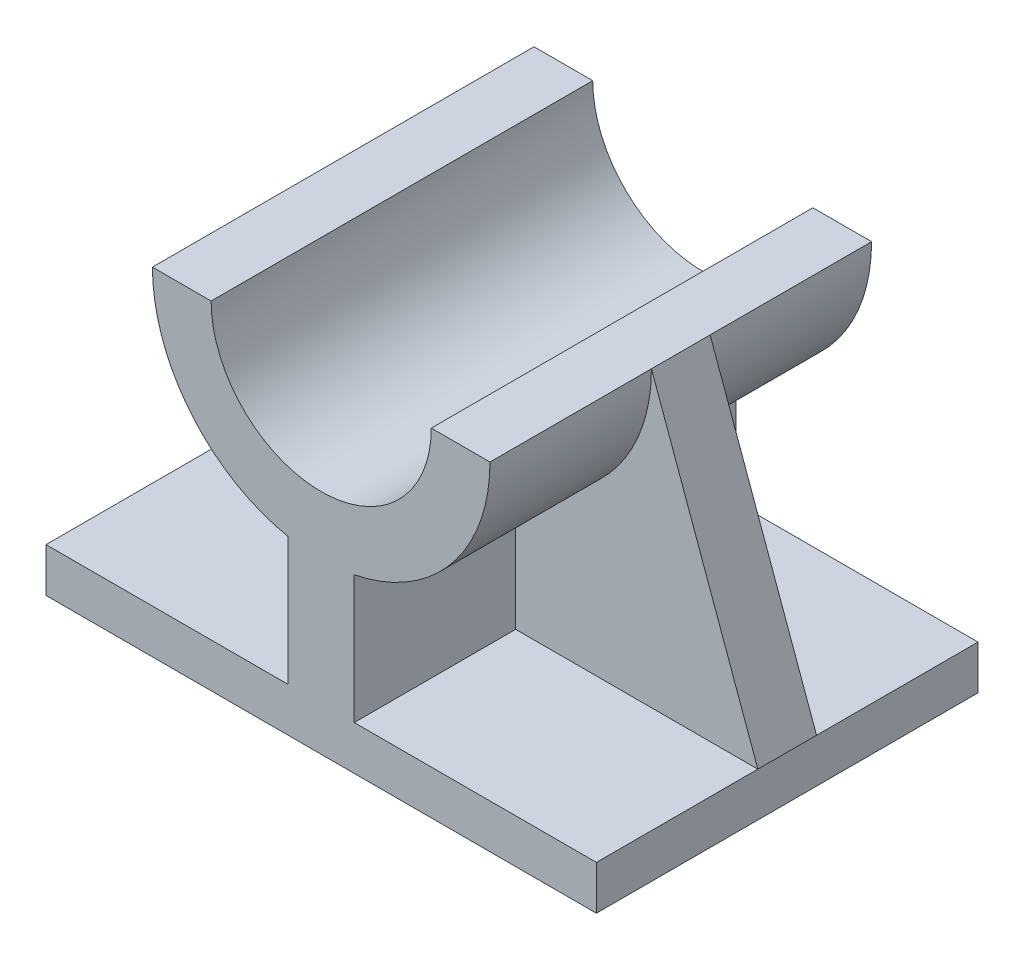
from build123d import *

# Parameters (mm, degrees)
BOSS_EXTRUDE1_DEPTH = 52
BOSS_EXTRUDE2_START = -22
BOSS_EXTRUDE2_DEPTH = 8


with BuildPart() as part:
    # Sketch1 → Boss-Extrude1 (new body)
    with BuildSketch(Plane.XY):
        with BuildLine():
            Line((-4.5, 20.444512863), (-4.5, 3))
            Line((-4.5, 3), (0, 3))
            Line((0, 3), (4.5, 3))
            Line((4.5, 3), (4.5, 20.444512863))
            ThreePointArc((4.5, 20.444512863), (17.783419244, 28.414047854), (23, 43))
            Line((23, 43), (15, 43))
            ThreePointArc((15, 43), (0, 28), (-15, 43))
            Line((-15, 43), (-23, 43))
            ThreePointArc((-23, 43), (-17.783419244, 28.414047854), (-4.5, 20.444512863))
        make_face()
        Polygon((-4.5, 3), (-37.5, 3), (-37.5, -3), (37.5, -3), (37.5, 3), (4.5, 3), (0, 3), align=None)
    extrude(amount=-BOSS_EXTRUDE1_DEPTH)

    # Sketch7 → Boss-Extrude2 (add)
    with BuildSketch(Plane.XY.offset(BOSS_EXTRUDE2_START)):
        with BuildLine():
            Line((23, 43), (37.5, 3))
            Line((37.5, 3), (4.5, 3))
            Line((4.5, 3), (4.5, 20.444512863))
            ThreePointArc((4.5, 20.444512863), (17.783419244, 28.414047854), (23, 43))
        make_face()
    extrude(amount=-BOSS_EXTRUDE2_DEPTH)


solid = part.part
